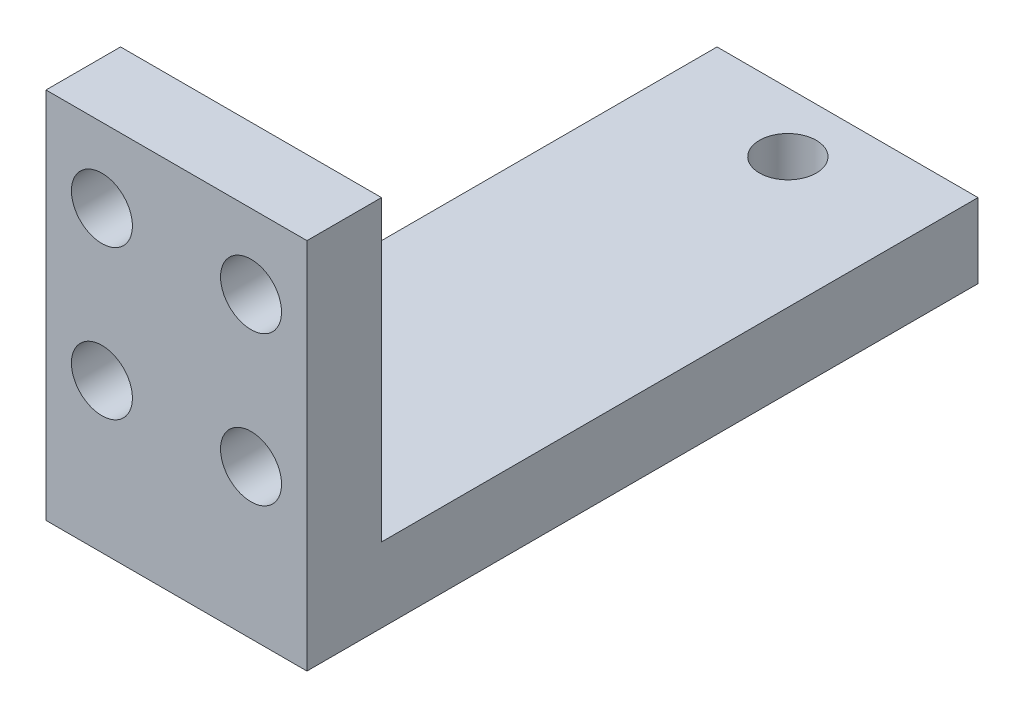
from build123d import *

# Parameters (mm, degrees)
SKETCH1_W               = 35
SKETCH1_H               = 90
BOSS_EXTRUDE1_DEPTH     = 10
SKETCH2_W               = 35
SKETCH2_H               = 10
BOSS_EXTRUDE2_DEPTH     = 40
CUT_EXTRUDE1_DEPTH      = 101.623058987
CUT_EXTRUDE1_DEPTH_BACK = 101.623058987
SKETCH3_R               = 4.090684301
SKETCH4_R               = 3.81
CUT_EXTRUDE2_DEPTH      = 105.522724802


with BuildPart() as part:
    # Sketch1 → Boss-Extrude1 (new body)
    with BuildSketch(Plane(origin=(0, 0, 0), x_dir=(1, 0, 0), z_dir=(0, 1, 0))):
        with Locations((17.5, 45)):
            Rectangle(SKETCH1_W, SKETCH1_H)
    extrude(amount=BOSS_EXTRUDE1_DEPTH)

    # Sketch2 → Boss-Extrude2 (add)
    with BuildSketch(Plane(origin=(0, 10, 0), x_dir=(1, 0, 0), z_dir=(0, 1, 0))):
        with Locations((17.5, 5)):
            Rectangle(SKETCH2_W, SKETCH2_H)
    extrude(amount=BOSS_EXTRUDE2_DEPTH)

    # Sketch3 → Cut-Extrude1 (cut, two sides: drawn at the far end of the back side and taken through both)
    with BuildSketch(Plane(origin=(0, 0, -10), x_dir=(-1, 0, 0), z_dir=(0, 0, -1)).offset(-CUT_EXTRUDE1_DEPTH_BACK)):
        with Locations((-27.5, 40)):
            Circle(SKETCH3_R)
        with Locations((-7.5, 40)):
            Circle(SKETCH3_R)
        with Locations((-7.5, 20)):
            Circle(SKETCH3_R)
        with Locations((-27.5, 20)):
            Circle(SKETCH3_R)
    extrude(amount=CUT_EXTRUDE1_DEPTH + CUT_EXTRUDE1_DEPTH_BACK, mode=Mode.SUBTRACT)

    # Sketch4 → Cut-Extrude2 (cut, through all)
    with BuildSketch(Plane(origin=(0, 10, 0), x_dir=(1, 0, 0), z_dir=(0, 1, 0))):
        with Locations(Location((17.5, 82, 0), (0, 0, 270))):
            Circle(SKETCH4_R)
    extrude(amount=-CUT_EXTRUDE2_DEPTH, mode=Mode.SUBTRACT)


solid = part.part
